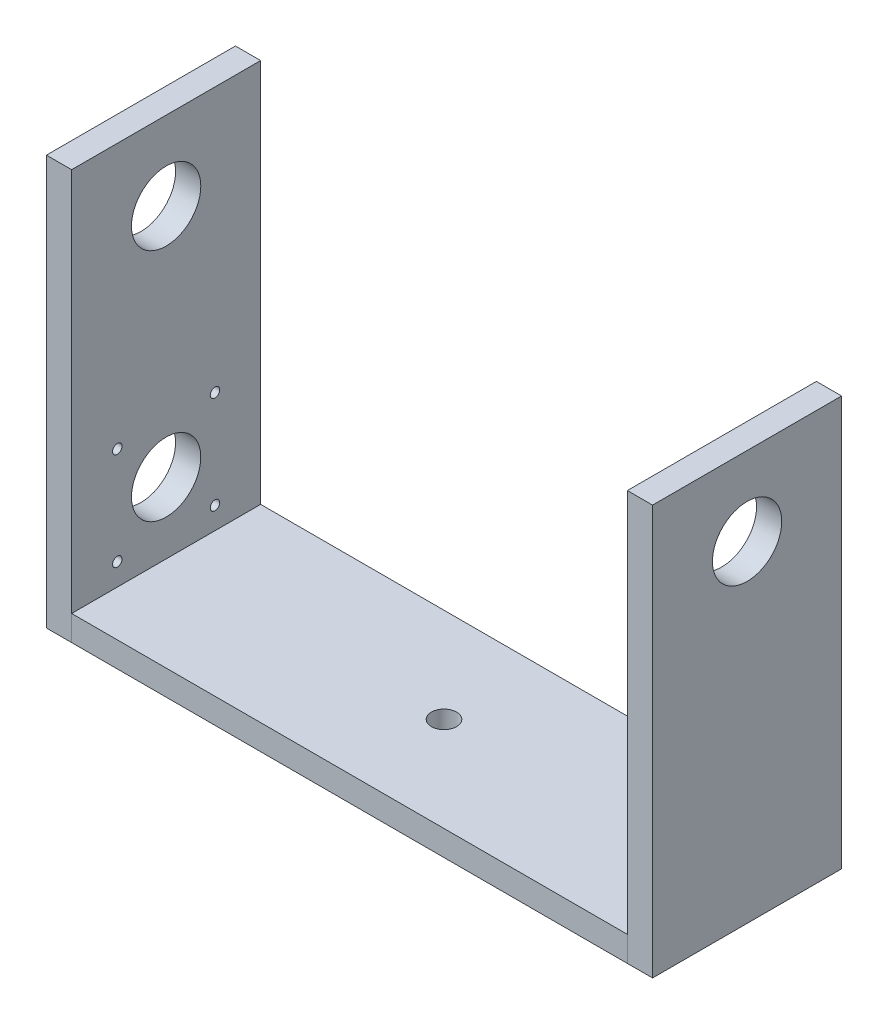
from build123d import *

# Parameters (mm, degrees)
SKETCH1_W           = 176.4
SKETCH1_H           = 8
BOSS_EXTRUDE1_DEPTH = 60
SKETCH2_W           = 60
SKETCH2_H           = 130
BOSS_EXTRUDE2_DEPTH = 8
SKETCH3_W           = 60
SKETCH3_H           = 130
BOSS_EXTRUDE3_DEPTH = 8
SKETCH4_R           = 11
CUT_EXTRUDE1_DEPTH  = 238.684160179
SKETCH5_R           = 4
CUT_EXTRUDE2_DEPTH  = 8
SKETCH6_R           = 1.5
SKETCH6_R_2         = 11
CUT_EXTRUDE3_DEPTH  = 8


with BuildPart() as part:
    # Sketch1 → Boss-Extrude1 (new body)
    with BuildSketch(Plane.XY):
        Rectangle(SKETCH1_W, SKETCH1_H)
    extrude(amount=BOSS_EXTRUDE1_DEPTH)

    # Sketch5 → Cut-Extrude2 (cut)
    with BuildSketch(Plane.XZ.offset(4)):
        with Locations(Location((0, 30, 0), (0, 0, 270))):
            Circle(SKETCH5_R)
    extrude(amount=-CUT_EXTRUDE2_DEPTH, mode=Mode.SUBTRACT)


with BuildPart() as body_2:
    # Sketch2 → Boss-Extrude2 (new body)
    with BuildSketch(Plane(origin=(88.2, 0, 0), x_dir=(0, 0, -1), z_dir=(1, 0, 0))):
        with Locations((-30, 61)):
            Rectangle(SKETCH2_W, SKETCH2_H)
    extrude(amount=BOSS_EXTRUDE2_DEPTH)


with BuildPart() as body_3:
    # Sketch3 → Boss-Extrude3 (new body)
    with BuildSketch(Plane.ZY.offset(88.2)):
        with Locations((30, 61)):
            Rectangle(SKETCH3_W, SKETCH3_H)
    extrude(amount=BOSS_EXTRUDE3_DEPTH)


with BuildPart() as cut_extrude1_tool:
    # Sketch4 → Cut-Extrude1 (new, through all)
    with BuildSketch(Plane(origin=(96.2, 0, 0), x_dir=(0, 0, -1), z_dir=(1, 0, 0))):
        with Locations((-30, 101)):
            Circle(SKETCH4_R)
    extrude(amount=-CUT_EXTRUDE1_DEPTH)


with BuildPart() as body_2_1:
    add(body_2.part)

    # Cut-Extrude1: cut by cut_extrude1_tool
    add(cut_extrude1_tool.part, mode=Mode.SUBTRACT)


with BuildPart() as body_3_1:
    add(body_3.part)

    # Cut-Extrude1: cut by cut_extrude1_tool
    add(cut_extrude1_tool.part, mode=Mode.SUBTRACT)

    # Sketch6 → Cut-Extrude3 (cut)
    with BuildSketch(Plane.ZY.offset(96.2)):
        with Locations((14.5, 42)):
            Circle(SKETCH6_R)
        with Locations((45.5, 42)):
            Circle(SKETCH6_R)
        with Locations((45.5, 11)):
            Circle(SKETCH6_R)
        with Locations((14.5, 11)):
            Circle(SKETCH6_R)
        with Locations((30, 26.5)):
            Circle(SKETCH6_R_2)
    extrude(amount=-CUT_EXTRUDE3_DEPTH, mode=Mode.SUBTRACT)


solid = Compound([part.part, body_2_1.part, body_3_1.part])
